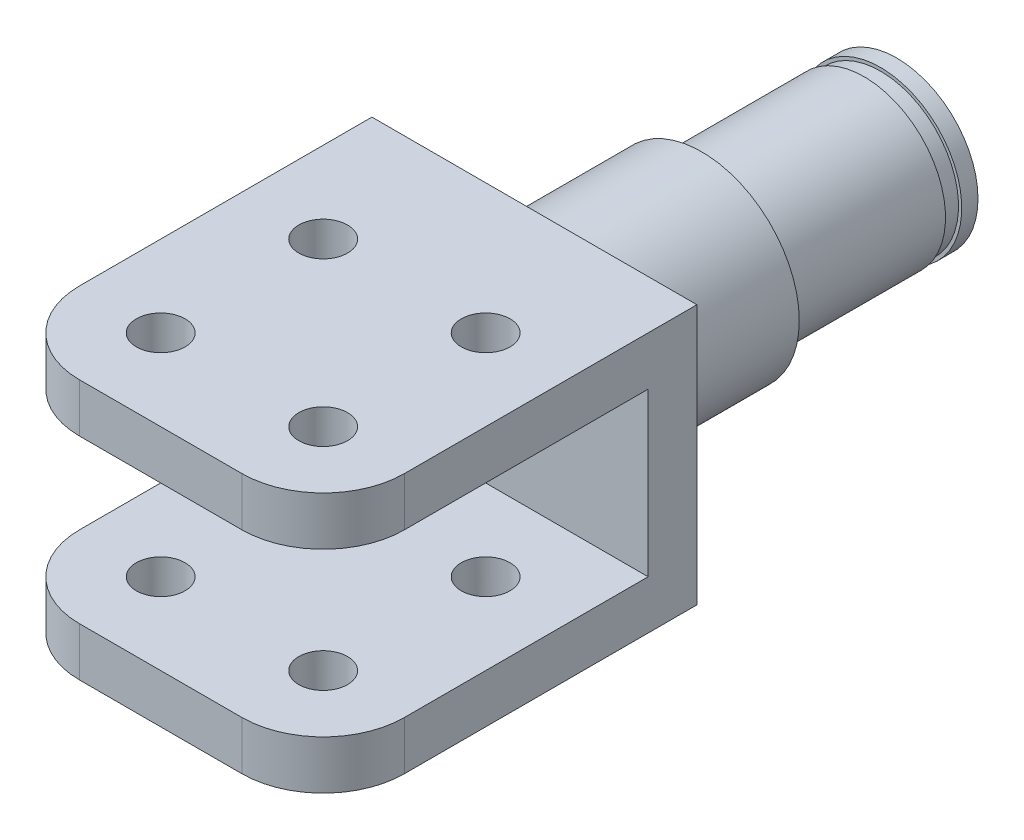
from build123d import *

# Parameters (mm, degrees)
SKETCH_1_R          = 5
EXTRUDE_1_DEPTH     = 12
SKETCH_2_R          = 5
SKETCH_2_R_2        = 4.8
CUT_EXTRUDE_1_DEPTH = 1
SKETCH_3_R          = 6
EXTRUDE_2_DEPTH     = 10.3
SKETCH_4_W          = 20
SKETCH_4_H          = 16
EXTRUDE_3_DEPTH     = 23
SKETCH_5_W          = 20
SKETCH_5_H          = 10
CUT_EXTRUDE_3_DEPTH = 20
SKETCH_6_R          = 1.5
CUT_EXTRUDE_4_DEPTH = 20
FILLET_1_R          = 5
SKETCH_7_R          = 2
CUT_EXTRUDE_5_DEPTH = 48.075365107


with BuildPart() as part:
    # 草图1 → 凸台-拉伸1 (new body)
    with BuildSketch(Plane.XY):
        Circle(SKETCH_1_R)
    extrude(amount=EXTRUDE_1_DEPTH)

    # 草图2 → 切除-拉伸1 (cut)
    with BuildSketch(Plane(origin=(0, 0, 1), x_dir=(-1, 0, 0), z_dir=(0, 0, -1))):
        Circle(SKETCH_2_R)
        Circle(SKETCH_2_R_2, mode=Mode.SUBTRACT)
    extrude(amount=-CUT_EXTRUDE_1_DEPTH, mode=Mode.SUBTRACT)

    # 草图3 → 凸台-拉伸2 (add)
    with BuildSketch(Plane.XY.offset(12)):
        with Locations(Location((0, 0, 0), (0, 0, 180))):
            Circle(SKETCH_3_R)
    extrude(amount=EXTRUDE_2_DEPTH)

    # 草图4 → 凸台-拉伸3 (add)
    with BuildSketch(Plane.XY.offset(22.3)):
        Rectangle(SKETCH_4_W, SKETCH_4_H)
    extrude(amount=EXTRUDE_3_DEPTH)

    # 草图5 → 切除-拉伸3 (cut)
    with BuildSketch(Plane.XY.offset(45.3)):
        Rectangle(SKETCH_5_W, SKETCH_5_H)
    extrude(amount=-CUT_EXTRUDE_3_DEPTH, mode=Mode.SUBTRACT)

    # 草图6 → 切除-拉伸4 (cut)
    with BuildSketch(Plane(origin=(0, 8, 0), x_dir=(1, 0, 0), z_dir=(0, 1, 0))):
        with Locations(Location((5, -40.3, 0), (0, 0, 270))):
            Circle(SKETCH_6_R)
        with Locations(Location((-5, -40.3, 0), (0, 0, 270))):
            Circle(SKETCH_6_R)
        with Locations(Location((-5, -30.3, 0), (0, 0, 270))):
            Circle(SKETCH_6_R)
        with Locations(Location((5, -30.3, 0), (0, 0, 270))):
            Circle(SKETCH_6_R)
    extrude(amount=-CUT_EXTRUDE_4_DEPTH, mode=Mode.SUBTRACT)

    # 圆角1
    fillet_1_edges = [part.edges().sort_by_distance(p)[0] for p in [
        (10, -6.5, 45.3),
        (-10, 6.5, 45.3),
        (10, 6.5, 45.3),
        (-10, -6.5, 45.3),
    ]]
    fillet(fillet_1_edges, radius=FILLET_1_R)

    # 草图7 → 切除-拉伸5 (cut, through all)
    with BuildSketch(Plane(origin=(0, 0, 0), x_dir=(-1, 0, 0), z_dir=(0, 0, -1))):
        Circle(SKETCH_7_R)
    extrude(amount=-CUT_EXTRUDE_5_DEPTH, mode=Mode.SUBTRACT)


solid = part.part
